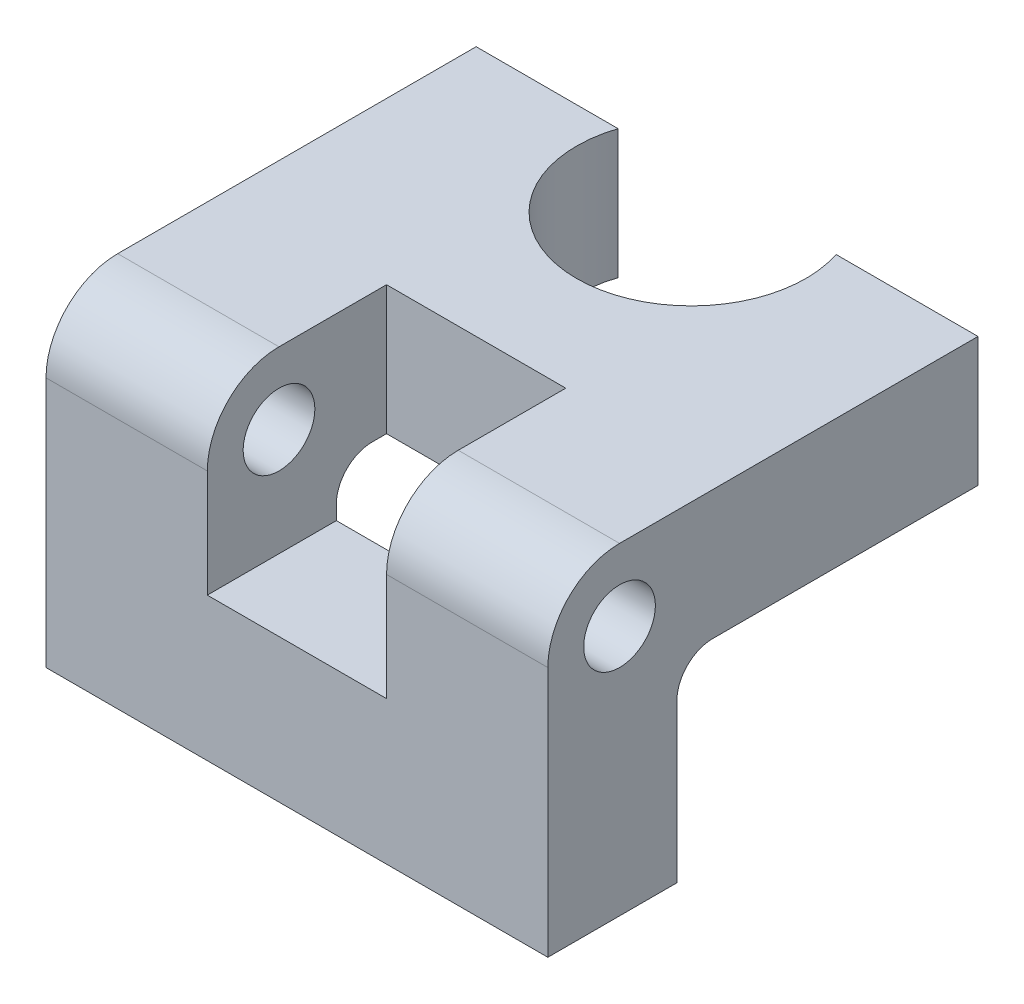
from build123d import *

# Parameters (mm, degrees)
SKETCH1_W           = 70
SKETCH1_H           = 60
BOSS_EXTRUDE1_DEPTH = 45
SKETCH2_W           = 42
SKETCH2_H           = 27
CUT_EXTRUDE1_DEPTH  = 103.591422643
SKETCH3_R           = 16
CUT_EXTRUDE2_DEPTH  = 45
SKETCH4_W           = 25
SKETCH4_H           = 25
CUT_EXTRUDE3_DEPTH  = 25
FILLET1_R           = 10
FILLET2_R           = 5
SKETCH9_R           = 5
CUT_EXTRUDE4_DEPTH  = 103.591422643


with BuildPart() as part:
    # Sketch1 → Boss-Extrude1 (new body)
    with BuildSketch(Plane(origin=(0, 0, 0), x_dir=(1, 0, 0), z_dir=(0, 1, 0))):
        with Locations((35, 30)):
            Rectangle(SKETCH1_W, SKETCH1_H)
    extrude(amount=BOSS_EXTRUDE1_DEPTH)

    # Sketch2 → Cut-Extrude1 (cut, through all)
    with BuildSketch(Plane(origin=(70, 0, 0), x_dir=(0, 0, -1), z_dir=(1, 0, 0))):
        with Locations((39, 13.5)):
            Rectangle(SKETCH2_W, SKETCH2_H)
    extrude(amount=-CUT_EXTRUDE1_DEPTH, mode=Mode.SUBTRACT)

    # Sketch3 → Cut-Extrude2 (cut)
    with BuildSketch(Plane(origin=(0, 45, 0), x_dir=(1, 0, 0), z_dir=(0, 1, 0))):
        with Locations((35, 55)):
            Circle(SKETCH3_R)
    extrude(amount=-CUT_EXTRUDE2_DEPTH, mode=Mode.SUBTRACT)

    # Sketch4 → Cut-Extrude3 (cut)
    with BuildSketch(Plane.XY):
        with Locations((35, 32.5)):
            Rectangle(SKETCH4_W, SKETCH4_H)
    extrude(amount=-CUT_EXTRUDE3_DEPTH, mode=Mode.SUBTRACT)

    # Fillet1
    fillet1_edges = [part.edges().sort_by_distance(p)[0] for p in [
        (58.75, 45, 0),
        (11.25, 45, 0),
    ]]
    fillet(fillet1_edges, radius=FILLET1_R)

    # Fillet2
    fillet2_edges = [part.edges().sort_by_distance(p)[0] for p in [
        (11.25, 27, -18),
        (58.75, 27, -18),
    ]]
    fillet(fillet2_edges, radius=FILLET2_R)

    # Sketch9 → Cut-Extrude4 (cut, through all)
    with BuildSketch(Plane(origin=(70, 0, 0), x_dir=(0, 0, -1), z_dir=(1, 0, 0))):
        with Locations((10, 35)):
            Circle(SKETCH9_R)
    extrude(amount=-CUT_EXTRUDE4_DEPTH, mode=Mode.SUBTRACT)


solid = part.part
